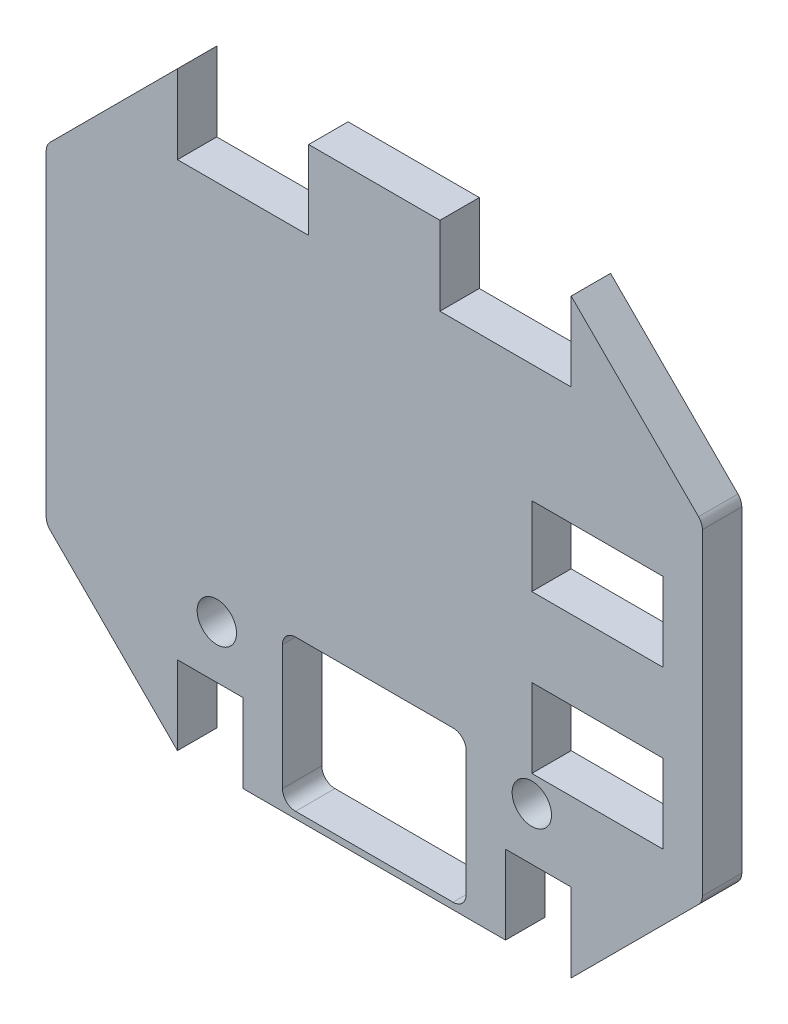
from build123d import *

# Parameters (mm, degrees)
SKETCH1_R           = 1.5
SKETCH1_W           = 14
SKETCH1_H           = 11.5
BOSS_EXTRUDE1_DEPTH = 3
SKETCH2_W           = 10
SKETCH2_H           = 6
SKETCH2_W_2         = 5
CUT_EXTRUDE1_DEPTH  = 62.10646447
SKETCH3_W           = 10
SKETCH3_H           = 6
CUT_EXTRUDE2_DEPTH  = 62.10646447
FILLET1_R           = 1


with BuildPart() as part:
    # Sketch1 → Boss-Extrude1 (new body)
    with BuildSketch(Plane.XY):
        Polygon((0, 0), (0, 25), (10, 35), (40, 35), (50, 25), (50, 0), (40, -10), (10, -10), align=None)
        with Locations((13, 0)):
            Circle(SKETCH1_R, mode=Mode.SUBTRACT)
        with Locations((37, 0)):
            Circle(SKETCH1_R, mode=Mode.SUBTRACT)
        with Locations((25, -3.75)):
            Rectangle(SKETCH1_W, SKETCH1_H, mode=Mode.SUBTRACT)
    extrude(amount=BOSS_EXTRUDE1_DEPTH)

    # Sketch2 → Cut-Extrude1 (cut, through all)
    with BuildSketch(Plane.XY.offset(3)):
        with Locations((15, 32)):
            Rectangle(SKETCH2_W, SKETCH2_H)
        with Locations((35, 32)):
            Rectangle(SKETCH2_W, SKETCH2_H)
        with Locations((12.5, -7)):
            Rectangle(SKETCH2_W_2, SKETCH2_H)
        with Locations((37.5, -7)):
            Rectangle(SKETCH2_W_2, SKETCH2_H)
    extrude(amount=-CUT_EXTRUDE1_DEPTH, mode=Mode.SUBTRACT)

    # Sketch3 → Cut-Extrude2 (cut, through all)
    with BuildSketch(Plane.XY.offset(3)):
        with Locations((42, 5)):
            Rectangle(SKETCH3_W, SKETCH3_H)
        with Locations((42, 17)):
            Rectangle(SKETCH3_W, SKETCH3_H)
    extrude(amount=-CUT_EXTRUDE2_DEPTH, mode=Mode.SUBTRACT)

    # Fillet1
    fillet1_edges = [part.edges().sort_by_distance(p)[0] for p in [
        (0, 0, 1.5),
        (0, 25, 1.5),
        (50, 25, 1.5),
        (50, 0, 1.5),
        (18, 2, 1.5),
        (18, -9.5, 1.5),
        (32, -9.5, 1.5),
        (32, 2, 1.5),
    ]]
    fillet(fillet1_edges, radius=FILLET1_R)


solid = part.part
